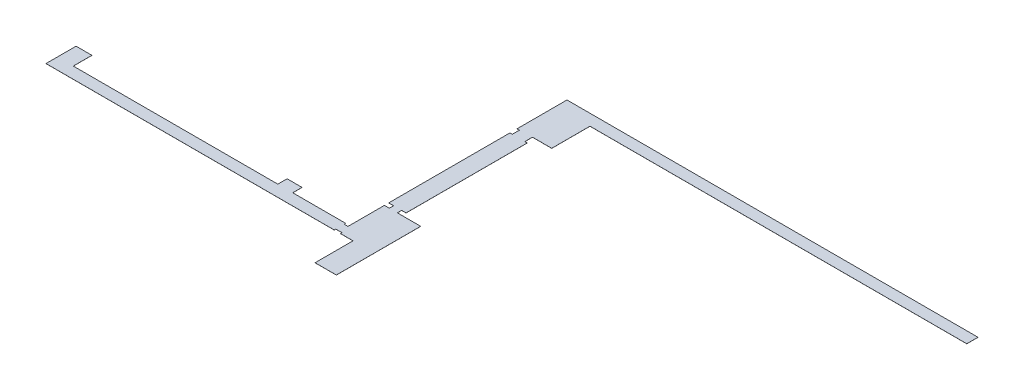
from build123d import *

# Parameters (mm, degrees)
SKETCH_1_W      = 2410
SKETCH_1_H      = 1500
EXTRUDE_1_DEPTH = 10


with BuildPart() as part:
    # 草图1 → 凸台-拉伸1 (new body)
    with BuildSketch(Plane(origin=(0, 0, 0), x_dir=(1, 0, 0), z_dir=(0, 1, 0))):
        with Locations((-20671.695078468, -34320)):
            Rectangle(SKETCH_1_W, SKETCH_1_H)
        Polygon((-7901.695078468, -9210), (-7901.695078468, -8070), (-7901.695078468, -7980), (-4796.695078468, -7980), (-4796.695078468, -1810), (55963.304921532, -1810), (55963.304921532, 0), (0, 0), (-10316.695078468, 0), (-10316.695078468, -8070), (-9931.695078468, -8070), (-9931.695078468, -9210), (-10316.695078468, -9210), (-10316.695078468, -28750), (-9516.695078468, -28750), (-9516.695078468, -29440), (-10316.695078468, -29440), (-10316.695078468, -35320), (-10916.695078468, -35320), (-10916.695078468, -35070), (-54856.695078468, -35070), (-54856.695078468, -32070), (-57406.695078468, -32070), (-57406.695078468, -36920), (-10916.695078468, -36920), (-10916.695078468, -36670), (-9896.695078468, -36670), (-9896.695078468, -36920), (-7896.695078468, -36920), (-7896.695078468, -43040), (-4466.695078468, -43040), (-4466.695078468, -29440), (-8236.695078468, -29440), (-8236.695078468, -28750), (-7516.695078468, -28750), (-7516.695078468, -9210), align=None)
    extrude(amount=EXTRUDE_1_DEPTH)


solid = part.part
